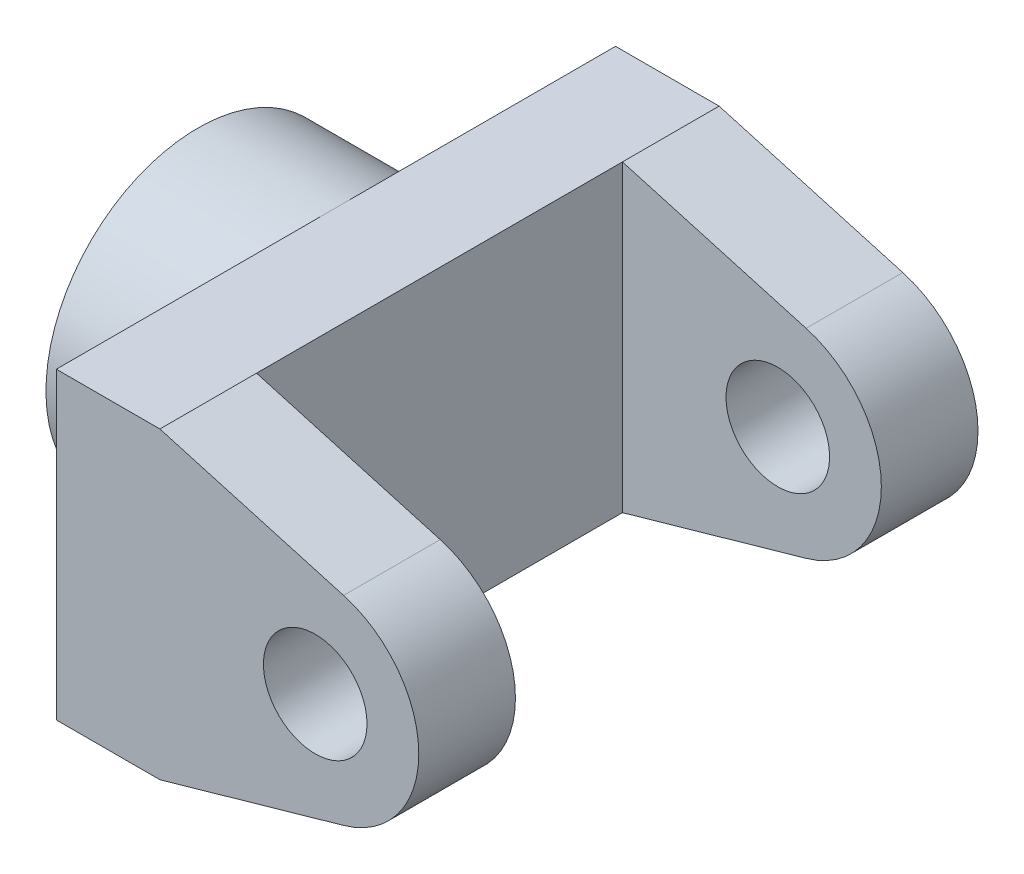
from build123d import *

# Parameters (mm, degrees)
SKETCH2_R           = 15
BOSS_EXTRUDE1_DEPTH = 162
SKETCH3_W           = 75
SKETCH3_H           = 106
CUT_EXTRUDE1_DEPTH  = 200.03014847
SKETCH4_R           = 44
SKETCH4_R_2         = 25
BOSS_EXTRUDE2_DEPTH = 40
CUT_EXTRUDE5_START  = -60
CUT_EXTRUDE5_DEPTH  = 60
SCALE1_SCALE        = 0.33


with BuildPart() as part:
    # Sketch2 → Boss-Extrude1 (new body)
    with BuildSketch(Plane.XY):
        with BuildLine():
            Line((-75, -44), (-45, -44))
            Line((-45, -44), (8.212754936, -28.853953912))
            ThreePointArc((8.212754936, -28.853953912), (30, 0), (8.212754936, 28.853953912))
            Line((8.212754936, 28.853953912), (-45, 44))
            Line((-45, 44), (-75, 44))
            Line((-75, 44), (-75, -44))
        make_face()
        Circle(SKETCH2_R, mode=Mode.SUBTRACT)
    extrude(amount=BOSS_EXTRUDE1_DEPTH)

    # Sketch3 → Cut-Extrude1 (cut, through all)
    with BuildSketch(Plane.XZ.offset(44)):
        with Locations((-7.5, 81)):
            Rectangle(SKETCH3_W, SKETCH3_H)
    extrude(amount=-CUT_EXTRUDE1_DEPTH, mode=Mode.SUBTRACT)

    # Sketch4 → Boss-Extrude2 (add)
    with BuildSketch(Plane.ZY.offset(75)):
        with Locations(Location((81, 0, 0), (0, 0, 270))):
            Circle(SKETCH4_R)
        with Locations(Location((81, 0, 0), (0, 0, 270))):
            Circle(SKETCH4_R_2, mode=Mode.SUBTRACT)
    extrude(amount=BOSS_EXTRUDE2_DEPTH)

    # Sketch7 → Cut-Extrude5 (cut)
    with BuildSketch(Plane.ZY.offset(115).offset(CUT_EXTRUDE5_START)):
        with BuildLine():
            Line((50.06906521, -4), (56.322074641, -4))
            ThreePointArc((56.322074641, -4), (56, 0), (56.322074641, 4))
            Line((56.322074641, 4), (50.06906521, 4))
            Line((50.06906521, 4), (50.06906521, -4))
        make_face()
    extrude(amount=CUT_EXTRUDE5_DEPTH, mode=Mode.SUBTRACT)


with BuildPart() as part_1:
    # Scale1: scaled about (-54.412588294, 0, 81.098775435)
    add(part.part.scale(SCALE1_SCALE).moved(Location((-36.456434157, 0, 54.336179541))))


solid = part_1.part
